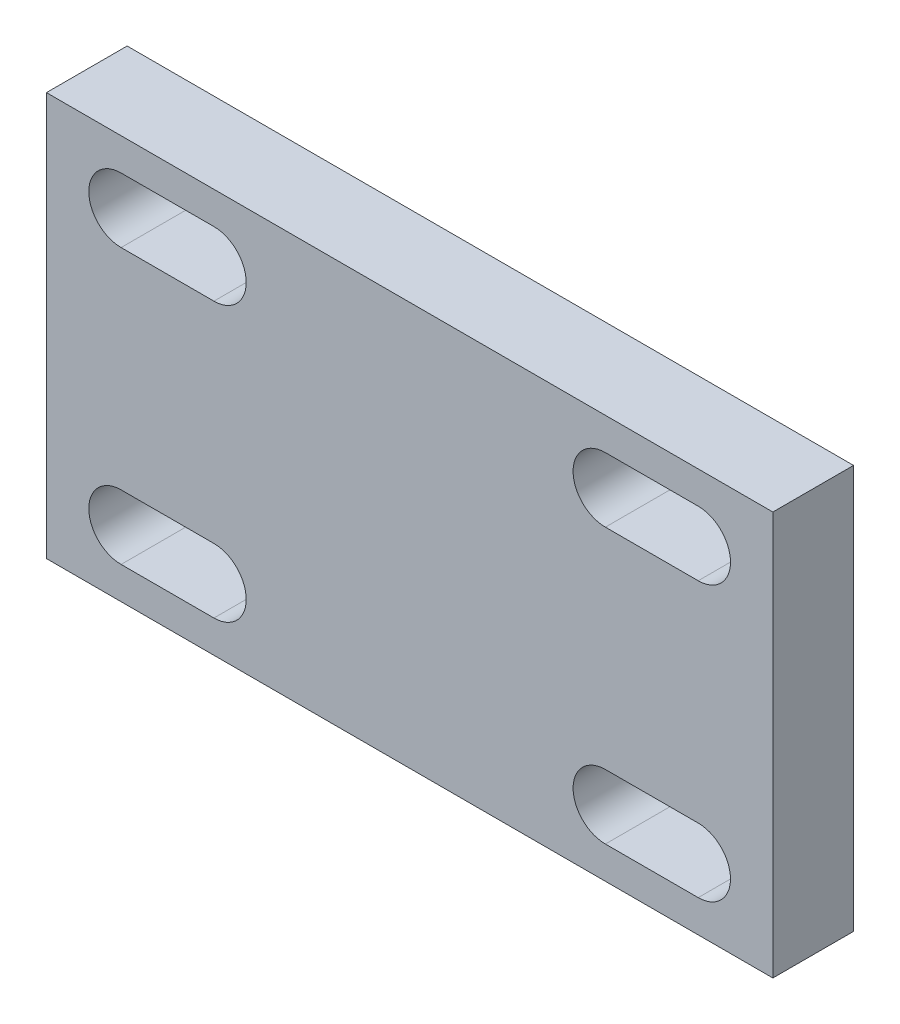
from build123d import *

# Parameters (mm, degrees)
ESBO_O3_W                = 90
ESBO_O3_H                = 50
RESSALTO_EXTRUS_O1_DEPTH = 10


with BuildPart() as part:
    # Esboço3 → Ressalto-extrusão1 (new body)
    with BuildSketch(Plane.XY):
        with Locations((45, 25)):
            Rectangle(ESBO_O3_W, ESBO_O3_H)
        with BuildLine():
            Line((9.25, 46), (20.75, 46))
            ThreePointArc((20.75, 46), (24.75, 42), (20.75, 38))
            Line((20.75, 38), (9.25, 38))
            ThreePointArc((9.25, 38), (5.25, 42), (9.25, 46))
        make_face(mode=Mode.SUBTRACT)
        with BuildLine():
            Line((80.75, 38), (69.25, 38))
            ThreePointArc((69.25, 38), (65.25, 42), (69.25, 46))
            Line((69.25, 46), (80.75, 46))
            ThreePointArc((80.75, 46), (84.75, 42), (80.75, 38))
        make_face(mode=Mode.SUBTRACT)
        with BuildLine():
            Line((9.25, 12), (20.75, 12))
            ThreePointArc((20.75, 12), (24.75, 8), (20.75, 4))
            Line((20.75, 4), (9.25, 4))
            ThreePointArc((9.25, 4), (5.25, 8), (9.25, 12))
        make_face(mode=Mode.SUBTRACT)
        with BuildLine():
            Line((69.25, 12), (80.75, 12))
            ThreePointArc((80.75, 12), (84.75, 8), (80.75, 4))
            Line((80.75, 4), (69.25, 4))
            ThreePointArc((69.25, 4), (65.25, 8), (69.25, 12))
        make_face(mode=Mode.SUBTRACT)
    extrude(amount=RESSALTO_EXTRUS_O1_DEPTH)


solid = part.part
